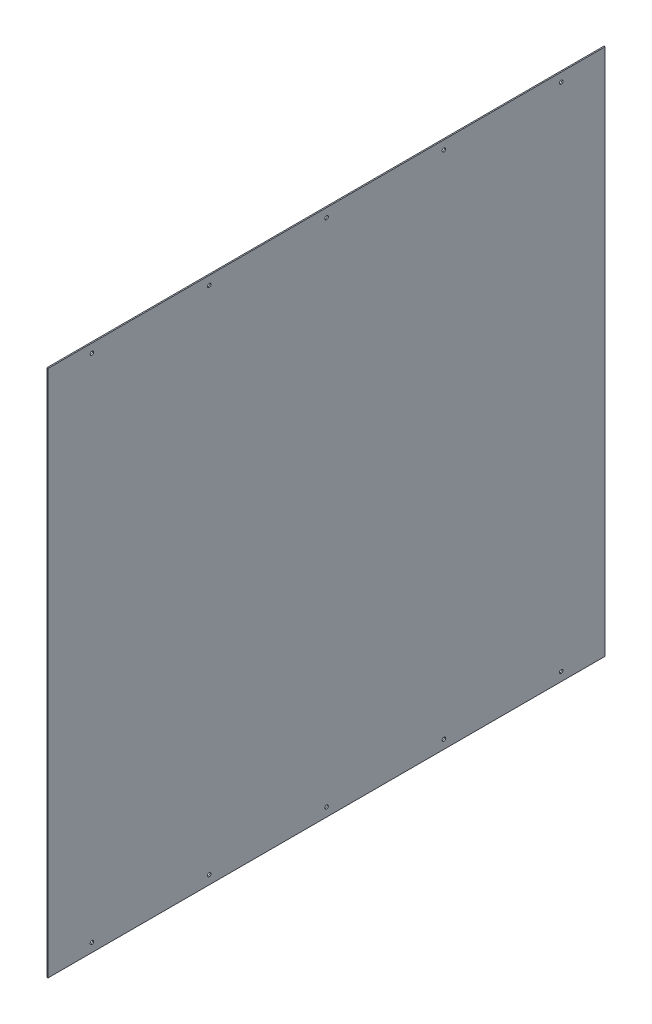
from build123d import *

# Parameters (mm, degrees)
SKETCH1_W           = 950
SKETCH1_H           = 900
BOSS_EXTRUDE2_DEPTH = 2
SKETCH3_R           = 3
CUT_EXTRUDE1_DEPTH  = 2


with BuildPart() as part:
    # Sketch1 → Boss-Extrude2 (new body)
    with BuildSketch(Plane(origin=(0, 0, 0), x_dir=(0, 0, -1), z_dir=(1, 0, 0))):
        Rectangle(SKETCH1_W, SKETCH1_H)
    extrude(amount=BOSS_EXTRUDE2_DEPTH)

    # Sketch3 → Cut-Extrude1 (cut)
    with BuildSketch(Plane(origin=(2, 0, 0), x_dir=(0, 0, -1), z_dir=(1, 0, 0))):
        with Locations((-400, 435)):
            Circle(SKETCH3_R)
        with Locations((-200, 435)):
            Circle(SKETCH3_R)
        with Locations((0, 435)):
            Circle(SKETCH3_R)
        with Locations((200, 435)):
            Circle(SKETCH3_R)
        with Locations((400, 435)):
            Circle(SKETCH3_R)
        with Locations(Location((400, -435, 0), (0, 0, 180))):
            Circle(SKETCH3_R)
        with Locations(Location((0, -435, 0), (0, 0, 180))):
            Circle(SKETCH3_R)
        with Locations(Location((200, -435, 0), (0, 0, 180))):
            Circle(SKETCH3_R)
        with Locations(Location((-200, -435, 0), (0, 0, 180))):
            Circle(SKETCH3_R)
        with Locations(Location((-400, -435, 0), (0, 0, 180))):
            Circle(SKETCH3_R)
    extrude(amount=-CUT_EXTRUDE1_DEPTH, mode=Mode.SUBTRACT)


solid = part.part
